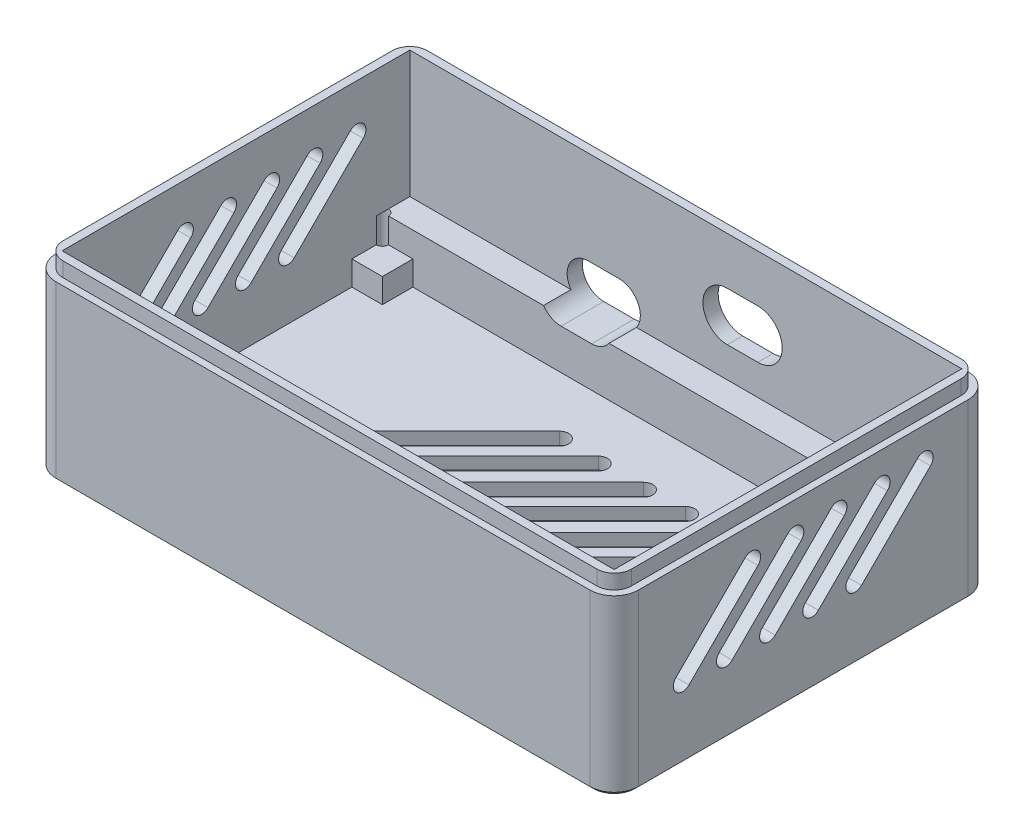
from build123d import *

# Parameters (mm, degrees)
CUERPO_DEPTH                  = 28.5
CROQUIS_HUECO_ESP32_W         = 90.5
CROQUIS_HUECO_ESP32_H         = 57
HUECO_ESP32_DEPTH             = 18.4
CROQUIS_HUECO_PCB_W           = 90.5
CROQUIS_HUECO_PCB_H           = 52.5
HUECO_PCB_DEPTH               = 8.1
CROQUIS_LABIO_W               = 90.5
CROQUIS_LABIO_H               = 57
LABIO_LIP_DEPTH               = 2.4
CROQUIS_APOYOS_W              = 5
CROQUIS_APOYOS_H              = 5
APOYOS_PCB_DEPTH              = 4
CROQUIS_ALIVIOS_R             = 1
ALIVIOS_ESQUINAS_DEPTH        = 8.1
SALIDAS_USB_Y_PANEL_DEPTH     = 66.881977809
VENTILAS_LATERALES_DEPTH      = 66.881977809
VENTILAS_LATERALES_DEPTH_BACK = 66.881977809
REJILLA_PISO_DEPTH            = 2
CHAFLAN_BASE_SIZE             = 0.6


with BuildPart() as part:
    # Croquis_contorno → Cuerpo (new body)
    with BuildSketch(Plane(origin=(0, 0, 0), x_dir=(1, 0, 0), z_dir=(0, 1, 0))):
        with BuildLine():
            Line((-43.75, -28.75), (43.75, -28.75))
            ThreePointArc((43.75, -28.75), (46.578427125, -27.578427125), (47.75, -24.75))
            Line((47.75, -24.75), (47.75, 29.25))
            ThreePointArc((47.75, 29.25), (46.578427125, 32.078427125), (43.75, 33.25))
            Line((43.75, 33.25), (-43.75, 33.25))
            ThreePointArc((-43.75, 33.25), (-46.578427125, 32.078427125), (-47.75, 29.25))
            Line((-47.75, 29.25), (-47.75, -24.75))
            ThreePointArc((-47.75, -24.75), (-46.578427125, -27.578427125), (-43.75, -28.75))
        make_face()
    extrude(amount=CUERPO_DEPTH)

    # Croquis_hueco_ESP32 → Hueco_ESP32 (cut)
    with BuildSketch(Plane(origin=(0, 28.5, 0), x_dir=(1, 0, 0), z_dir=(0, 1, 0))):
        with Locations((0, 2.25)):
            Rectangle(CROQUIS_HUECO_ESP32_W, CROQUIS_HUECO_ESP32_H)
    extrude(amount=-HUECO_ESP32_DEPTH, mode=Mode.SUBTRACT)

    # Croquis_hueco_PCB → Hueco_PCB (cut)
    with BuildSketch(Plane(origin=(0, 10.1, 0), x_dir=(1, 0, 0), z_dir=(0, 1, 0))):
        Rectangle(CROQUIS_HUECO_PCB_W, CROQUIS_HUECO_PCB_H)
    extrude(amount=-HUECO_PCB_DEPTH, mode=Mode.SUBTRACT)

    # Croquis_labio → Labio_lip (add)
    with BuildSketch(Plane(origin=(0, 28.5, 0), x_dir=(1, 0, 0), z_dir=(0, 1, 0))):
        with BuildLine():
            Line((-43.75, -27.6), (43.75, -27.6))
            ThreePointArc((43.75, -27.6), (45.765254326, -26.765254326), (46.6, -24.75))
            Line((46.6, -24.75), (46.6, 29.25))
            ThreePointArc((46.6, 29.25), (45.765254326, 31.265254326), (43.75, 32.1))
            Line((43.75, 32.1), (-43.75, 32.1))
            ThreePointArc((-43.75, 32.1), (-45.765254326, 31.265254326), (-46.6, 29.25))
            Line((-46.6, 29.25), (-46.6, -24.75))
            ThreePointArc((-46.6, -24.75), (-45.765254326, -26.765254326), (-43.75, -27.6))
        make_face()
        with Locations((0, 2.25)):
            Rectangle(CROQUIS_LABIO_W, CROQUIS_LABIO_H, mode=Mode.SUBTRACT)
    extrude(amount=LABIO_LIP_DEPTH)

    # Croquis_apoyos → Apoyos_PCB (add)
    with BuildSketch(Plane(origin=(0, 2, 0), x_dir=(1, 0, 0), z_dir=(0, 1, 0))):
        with Locations((-42.75, -23.75)):
            Rectangle(CROQUIS_APOYOS_W, CROQUIS_APOYOS_H)
        with Locations((-42.75, 23.75)):
            Rectangle(CROQUIS_APOYOS_W, CROQUIS_APOYOS_H)
        with Locations((42.75, -23.75)):
            Rectangle(CROQUIS_APOYOS_W, CROQUIS_APOYOS_H)
        with Locations((42.75, 23.75)):
            Rectangle(CROQUIS_APOYOS_W, CROQUIS_APOYOS_H)
    extrude(amount=APOYOS_PCB_DEPTH)

    # Croquis_alivios → Alivios_esquinas (cut)
    with BuildSketch(Plane(origin=(0, 2, 0), x_dir=(1, 0, 0), z_dir=(0, 1, 0))):
        with Locations(Location((-45.25, -26.25, 0), (0, 0, 90))):
            Circle(CROQUIS_ALIVIOS_R)
        with Locations(Location((-45.25, 26.25, 0), (0, 0, 270))):
            Circle(CROQUIS_ALIVIOS_R)
        with Locations(Location((45.25, -26.25, 0), (0, 0, 90))):
            Circle(CROQUIS_ALIVIOS_R)
        with Locations(Location((45.25, 26.25, 0), (0, 0, 270))):
            Circle(CROQUIS_ALIVIOS_R)
    extrude(amount=ALIVIOS_ESQUINAS_DEPTH, mode=Mode.SUBTRACT)

    # Croquis_salidas → Salidas_USB_y_panel (cut, through all)
    with BuildSketch(Plane.XY):
        with BuildLine():
            Line((6.8, 23.1), (11.8, 23.1))
            ThreePointArc((11.8, 23.1), (15.8, 19.1), (11.8, 15.1))
            Line((11.8, 15.1), (6.8, 15.1))
            ThreePointArc((6.8, 15.1), (2.8, 19.1), (6.8, 23.1))
        make_face()
        with BuildLine():
            Line((-15.96, 15.6), (-10.96, 15.6))
            ThreePointArc((-10.96, 15.6), (-7.46, 12.1), (-10.96, 8.6))
            Line((-10.96, 8.6), (-15.96, 8.6))
            ThreePointArc((-15.96, 8.6), (-19.46, 12.1), (-15.96, 15.6))
        make_face()
    extrude(amount=-SALIDAS_USB_Y_PANEL_DEPTH, mode=Mode.SUBTRACT)

    # Croquis_ventilas → Ventilas_laterales (cut, two sides: drawn at the far end of the back side and taken through both)
    with BuildSketch(Plane(origin=(0, 0, 0), x_dir=(0, 0, -1), z_dir=(1, 0, 0)).offset(-VENTILAS_LATERALES_DEPTH_BACK)):
        with BuildLine():
            Line((-18.609650045, 13.003805922), (-7.295941546, 24.317514421))
            ThreePointArc((-7.295941546, 24.317514421), (-5.174621202, 24.317514421), (-5.174621202, 22.196194078))
            Line((-5.174621202, 22.196194078), (-16.488329701, 10.882485579))
            ThreePointArc((-16.488329701, 10.882485579), (-18.609650045, 10.882485579), (-18.609650045, 13.003805922))
        make_face()
        with BuildLine():
            Line((-11.538582233, 13.003805922), (-0.224873734, 24.317514421))
            ThreePointArc((-0.224873734, 24.317514421), (1.896446609, 24.317514421), (1.896446609, 22.196194078))
            Line((1.896446609, 22.196194078), (-9.41726189, 10.882485579))
            ThreePointArc((-9.41726189, 10.882485579), (-11.538582233, 10.882485579), (-11.538582233, 13.003805922))
        make_face()
        with BuildLine():
            Line((-4.467514421, 13.003805922), (6.846194078, 24.317514421))
            ThreePointArc((6.846194078, 24.317514421), (8.967514421, 24.317514421), (8.967514421, 22.196194078))
            Line((8.967514421, 22.196194078), (-2.346194078, 10.882485579))
            ThreePointArc((-2.346194078, 10.882485579), (-4.467514421, 10.882485579), (-4.467514421, 13.003805922))
        make_face()
        with BuildLine():
            Line((2.603553391, 13.003805922), (13.91726189, 24.317514421))
            ThreePointArc((13.91726189, 24.317514421), (16.038582233, 24.317514421), (16.038582233, 22.196194078))
            Line((16.038582233, 22.196194078), (4.724873734, 10.882485579))
            ThreePointArc((4.724873734, 10.882485579), (2.603553391, 10.882485579), (2.603553391, 13.003805922))
        make_face()
        with BuildLine():
            Line((9.674621202, 13.003805922), (20.988329701, 24.317514421))
            ThreePointArc((20.988329701, 24.317514421), (23.109650045, 24.317514421), (23.109650045, 22.196194078))
            Line((23.109650045, 22.196194078), (11.795941546, 10.882485579))
            ThreePointArc((11.795941546, 10.882485579), (9.674621202, 10.882485579), (9.674621202, 13.003805922))
        make_face()
    extrude(amount=VENTILAS_LATERALES_DEPTH + VENTILAS_LATERALES_DEPTH_BACK, mode=Mode.SUBTRACT)

    # Croquis_rejilla_piso → Rejilla_piso (cut)
    with BuildSketch(Plane(origin=(0, 0, 0), x_dir=(1, 0, 0), z_dir=(0, 1, 0))):
        with BuildLine():
            Line((-36.769552622, -11.185028843), (-7.778174593, 17.806349186))
            ThreePointArc((-7.778174593, 17.806349186), (-5.656854249, 17.806349186), (-5.656854249, 15.685028843))
            Line((-5.656854249, 15.685028843), (-34.648232278, -13.306349186))
            ThreePointArc((-34.648232278, -13.306349186), (-36.769552622, -13.306349186), (-36.769552622, -11.185028843))
        make_face()
        with BuildLine():
            Line((-29.69848481, -11.185028843), (-1.060660172, 17.452795796))
            ThreePointArc((-1.060660172, 17.452795796), (1.060660172, 17.452795796), (1.060660172, 15.331475452))
            Line((1.060660172, 15.331475452), (-27.577164466, -13.306349186))
            ThreePointArc((-27.577164466, -13.306349186), (-29.69848481, -13.306349186), (-29.69848481, -11.185028843))
        make_face()
        with BuildLine():
            Line((-22.273863607, -11.185028843), (6.363961031, 17.452795796))
            ThreePointArc((6.363961031, 17.452795796), (8.485281374, 17.452795796), (8.485281374, 15.331475452))
            Line((8.485281374, 15.331475452), (-20.152543264, -13.306349186))
            ThreePointArc((-20.152543264, -13.306349186), (-22.273863607, -13.306349186), (-22.273863607, -11.185028843))
        make_face()
        with BuildLine():
            Line((-15.379572491, -11.185028843), (13.258252147, 17.452795796))
            ThreePointArc((13.258252147, 17.452795796), (15.379572491, 17.452795796), (15.379572491, 15.331475452))
            Line((15.379572491, 15.331475452), (-13.258252147, -13.306349186))
            ThreePointArc((-13.258252147, -13.306349186), (-15.379572491, -13.306349186), (-15.379572491, -11.185028843))
        make_face()
        with BuildLine():
            Line((-7.954951288, -11.185028843), (20.68287335, 17.452795796))
            ThreePointArc((20.68287335, 17.452795796), (22.804193693, 17.452795796), (22.804193693, 15.331475452))
            Line((22.804193693, 15.331475452), (-5.833630945, -13.306349186))
            ThreePointArc((-5.833630945, -13.306349186), (-7.954951288, -13.306349186), (-7.954951288, -11.185028843))
        make_face()
        with BuildLine():
            Line((-1.060660172, -11.185028843), (27.577164466, 17.452795796))
            ThreePointArc((27.577164466, 17.452795796), (29.69848481, 17.452795796), (29.69848481, 15.331475452))
            Line((29.69848481, 15.331475452), (1.060660172, -13.306349186))
            ThreePointArc((1.060660172, -13.306349186), (-1.060660172, -13.306349186), (-1.060660172, -11.185028843))
        make_face()
        with BuildLine():
            Line((5.303300859, -11.185028843), (34.471455583, 17.983125881))
            ThreePointArc((34.471455583, 17.983125881), (36.592775926, 17.983125881), (36.592775926, 15.861805538))
            Line((36.592775926, 15.861805538), (7.424621202, -13.306349186))
            ThreePointArc((7.424621202, -13.306349186), (5.303300859, -13.306349186), (5.303300859, -11.185028843))
        make_face()
    extrude(amount=REJILLA_PISO_DEPTH, mode=Mode.SUBTRACT)

    # Chaflan_base
    chaflan_base_edges = [part.edges().sort_by_distance(p)[0] for p in [
        (47.75, 0, -2.25),
        (46.578427125, 0, 27.578427125),
        (0, 0, 28.75),
        (-46.578427125, 0, 27.578427125),
        (-47.75, 0, -2.25),
        (-46.578427125, 0, -32.078427125),
        (0, 0, -33.25),
        (46.578427125, 0, -32.078427125),
    ]]
    chamfer(chaflan_base_edges, length=CHAFLAN_BASE_SIZE)


solid = part.part
